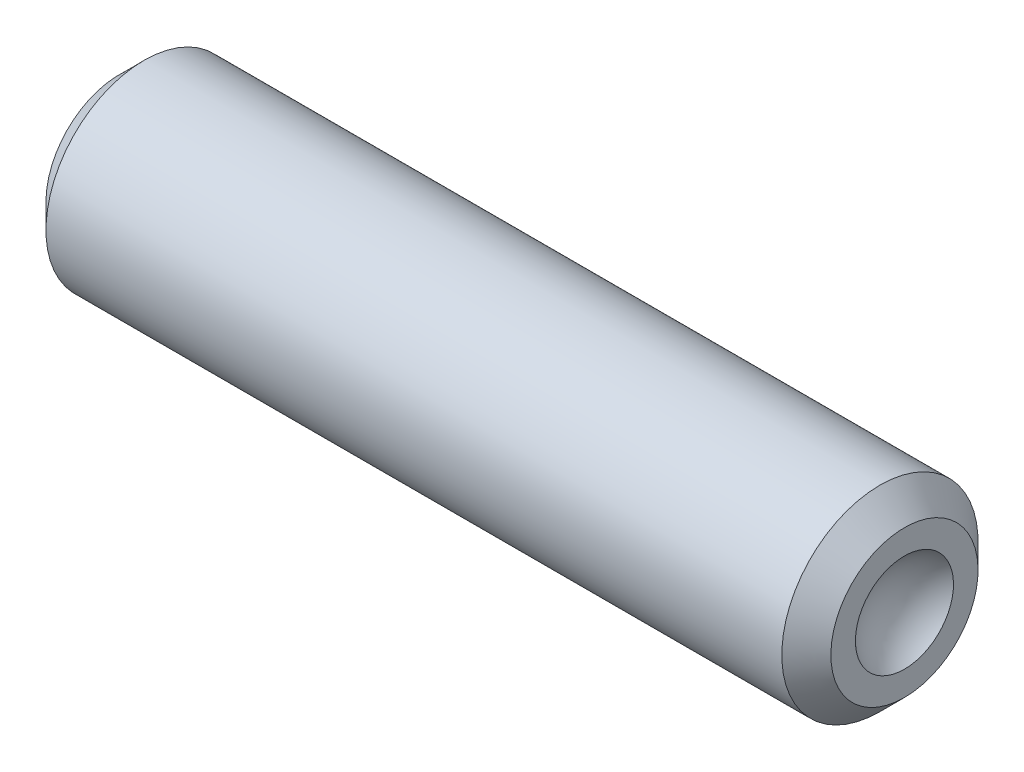
from build123d import *

# Parameters (mm, degrees)
CUT_EXTRUDE1_DEPTH = 14


with BuildPart() as part:
    # Sketch1 → Revolve1 (revolve)
    with BuildSketch(Plane.XY, mode=Mode.PRIVATE) as revolve1_sk:
        with BuildLine():
            Line((0, 0), (0, 1.5))
            Line((0, 1.5), (0.5, 2))
            Line((0.5, 2), (15.5, 2))
            Line((15.5, 2), (16, 1.5))
            Line((16, 1.5), (16, 1))
            ThreePointArc((16, 1), (15.631966011, 0.559016994), (15.5, 0))
            Line((15.5, 0), (0, 0))
        make_face()
    revolve(revolve1_sk.sketch.rotate(Axis((0, 0, 0), (1, 0, 0)), 180), axis=Axis((0, 0, 0), (1, 0, 0)))

    # Sketch2 → Cut-Extrude1 (cut)
    with BuildSketch(Plane.ZY):
        Polygon((0, 1.154700538), (-1, 0.577350269), (-1, -0.577350269), (0, -1.154700538), (1, -0.577350269), (1, 0.577350269), align=None)
    extrude(amount=-CUT_EXTRUDE1_DEPTH, mode=Mode.SUBTRACT)


solid = part.part
